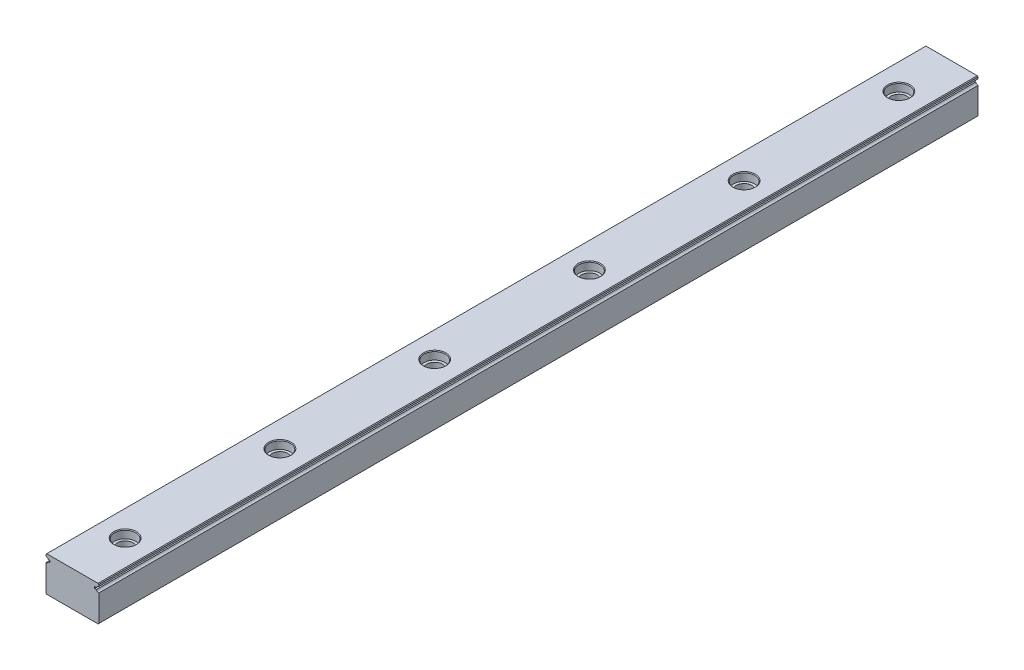
from build123d import *

# Parameters (mm, degrees)
EXTRUDE1_DEPTH             = 250
EXTRUDE2_REACH             = 252.312
SKETCH2_R                  = 2.25
SKETCH_R                   = 3
SKETCH_R_2                 = 2.25
EXTRUDE4_DEPTH             = 2.3
CHAMFER1_SIZE              = 0.2
LPATTERN1_COUNT            = 6
LPATTERN1_PITCH            = 44
CHAMFER1_OF_LPATTERN1_SIZE = 0.2


with BuildPart() as part:
    # Sketch1 → Extrude1 (new body)
    with BuildSketch(Plane.XY):
        with BuildLine():
            Line((-7.3, -5), (7.3, -5))
            Line((7.3, -5), (7.5, -4.8))
            Line((7.5, -4.8), (7.5, 2.706274607))
            ThreePointArc((7.5, 2.706274607), (7.091294745, 2.882570681), (6.840065792, 3.25))
            Line((6.840065792, 3.25), (6.340065792, 3.25))
            Line((6.340065792, 3.25), (6.340065792, 3.75))
            Line((6.340065792, 3.75), (6.840065792, 3.75))
            ThreePointArc((6.840065792, 3.75), (7.091294745, 4.117429319), (7.5, 4.293725393))
            Line((7.5, 4.293725393), (7.5, 4.8))
            Line((7.5, 4.8), (7.3, 5))
            Line((7.3, 5), (-7.3, 5))
            Line((-7.3, 5), (-7.5, 4.8))
            Line((-7.5, 4.8), (-7.5, 4.293725393))
            ThreePointArc((-7.5, 4.293725393), (-7.091294745, 4.117429319), (-6.840065792, 3.75))
            Line((-6.840065792, 3.75), (-6.340065792, 3.75))
            Line((-6.340065792, 3.75), (-6.340065792, 3.25))
            Line((-6.340065792, 3.25), (-6.840065792, 3.25))
            ThreePointArc((-6.840065792, 3.25), (-7.091294745, 2.882570681), (-7.5, 2.706274607))
            Line((-7.5, 2.706274607), (-7.5, -4.8))
            Line((-7.5, -4.8), (-7.3, -5))
        make_face()
    extrude(amount=EXTRUDE1_DEPTH)

    # Sketch2 → Extrude2 (cut, up to next)
    with BuildSketch(Plane(origin=(0, 5, 0), x_dir=(1, 0, 0), z_dir=(0, 1, 0)), mode=Mode.PRIVATE) as extrude2_sk1:
        with Locations(Location((0, -15, 0), (0, 0, 270))):
            Circle(SKETCH2_R)
    extrude2_tool1 = extrude(extrude2_sk1.sketch, amount=-EXTRUDE2_REACH, mode=Mode.PRIVATE) & part.part
    extrude2 = extrude2_tool1.solids().sort_by_distance((0, 5, 15))[0]
    add(extrude2, mode=Mode.SUBTRACT)

    # Sketch → Extrude4 (cut)
    with BuildSketch(Plane(origin=(0, 5, 0), x_dir=(1, 0, 0), z_dir=(0, 1, 0))):
        with Locations(Location((0, -15, 0), (0, 0, 270))):
            Circle(SKETCH_R)
        with Locations(Location((0, -15, 0), (0, 0, 270))):
            Circle(SKETCH_R_2, mode=Mode.SUBTRACT)
    extrude4 = extrude(amount=-EXTRUDE4_DEPTH, mode=Mode.SUBTRACT)

    # Chamfer1
    chamfer1_edges = [part.edges().sort_by_distance(p)[0] for p in [
        (0, -5, 12.75),
        (0, 5, 12),
    ]]
    chamfer(chamfer1_edges, length=CHAMFER1_SIZE)

    # LPattern1: Extrude2, Extrude4 ×6
    with Locations(*[(0, 0, i * LPATTERN1_PITCH) for i in range(1, LPATTERN1_COUNT)]):
        add(extrude2, mode=Mode.SUBTRACT)
        add(extrude4, mode=Mode.SUBTRACT)

    # Chamfer1 of LPattern1
    chamfer1_of_lpattern1_edges = [part.edges().sort_by_distance(p)[0] for p in [
        (0, -5, 56.75),
        (0, 5, 56),
        (0, -5, 100.75),
        (0, 5, 100),
        (0, -5, 144.75),
        (0, 5, 144),
        (0, -5, 188.75),
        (0, 5, 188),
        (0, -5, 232.75),
        (0, 5, 232),
    ]]
    chamfer(chamfer1_of_lpattern1_edges, length=CHAMFER1_OF_LPATTERN1_SIZE)


solid = part.part
